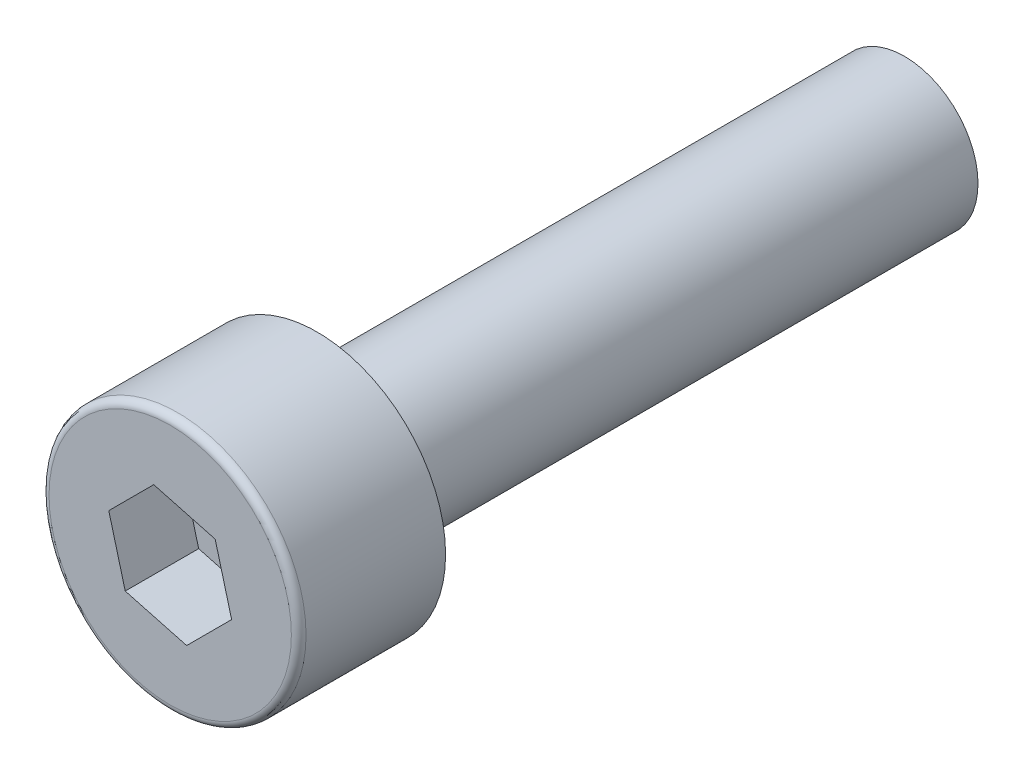
from build123d import *

# Parameters (mm, degrees)
SKETCH_1_R          = 3.5
EXTRUDE_1_DEPTH     = 4
CUT_EXTRUDE_1_DEPTH = 2
SKETCH_3_R          = 2
EXTRUDE_2_DEPTH     = 16
FILLET_1_R          = 0.2


with BuildPart() as part:
    # 草图1 → 凸台-拉伸1 (new body)
    with BuildSketch(Plane.XY):
        Circle(SKETCH_1_R)
    extrude(amount=EXTRUDE_1_DEPTH)

    # 草图2 → 切除-拉伸1 (cut)
    with BuildSketch(Plane.XY.offset(4)):
        Polygon((-1.224744871, -1.224744871), (0.448287736, -1.673032607), (1.673032607, -0.448287736), (1.224744871, 1.224744871), (-0.448287736, 1.673032607), (-1.673032607, 0.448287736), align=None)
    extrude(amount=-CUT_EXTRUDE_1_DEPTH, mode=Mode.SUBTRACT)

    # 草图3 → 凸台-拉伸2 (add)
    with BuildSketch(Plane(origin=(0, 0, 0), x_dir=(-1, 0, 0), z_dir=(0, 0, -1))):
        with Locations(Location((0, 0, 0), (0, 0, 180))):
            Circle(SKETCH_3_R)
    extrude(amount=EXTRUDE_2_DEPTH)

    # 圆角1
    fillet_1_edges = [part.edges().sort_by_distance(p)[0] for p in [
        (-3.5, 0, 4),
    ]]
    fillet(fillet_1_edges, radius=FILLET_1_R)


solid = part.part
